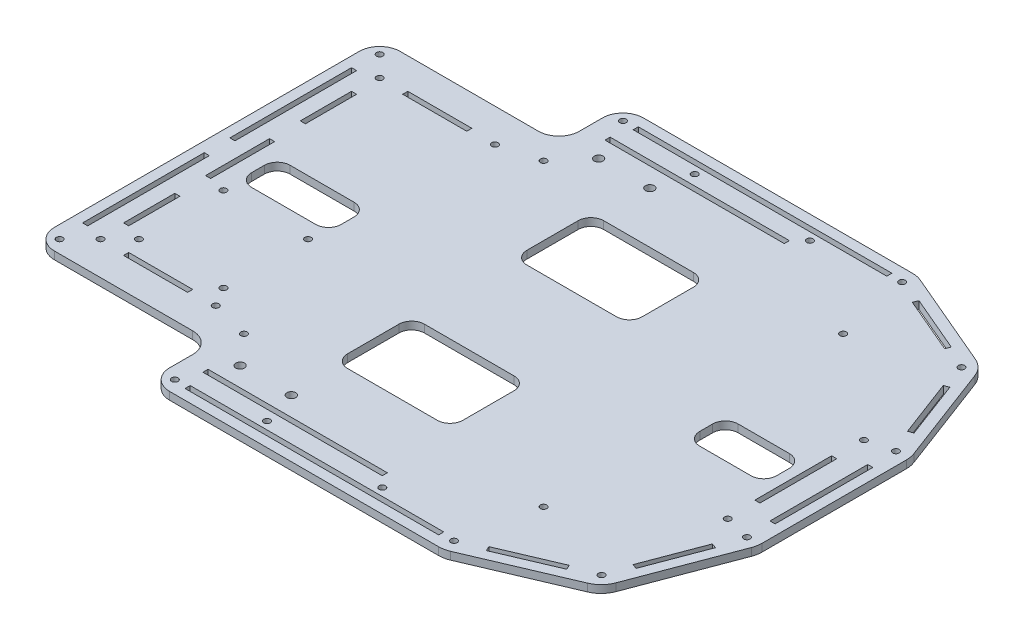
from build123d import *

# Parameters (mm, degrees)
ESTRUSIONE_ESTRUSIONE1_DEPTH  = 3
FORO_FILETTATO_M3X0_5_1_D     = 2.5
FORO_FILETTATO_M3X0_5_1_DEPTH = 7.5
FORO_FILETTATO_M3X0_5_1_TIP   = 0.751075774
SCHIZZO4_W                    = 89.03043591
SCHIZZO4_H                    = 2
TAGLIO_ESTRUSIONE2_DEPTH      = 10
FORO_FILETTATO_M3X0_5_7_D     = 2.5
SCHIZZO29_W                   = 5
SCHIZZO29_H                   = 2
TAGLIO_ESTRUSIONE13_DEPTH     = 10
SCHIZZO7_W                    = 2
SCHIZZO7_H                    = 47.5
TAGLIO_ESTRUSIONE5_DEPTH      = 10
SCHIZZO10_W                   = 2
SCHIZZO10_H                   = 38.172865154
TAGLIO_ESTRUSIONE6_DEPTH      = 262.897403576
FORO_FILETTATO_M3X0_5_2_D     = 2.5
SCHIZZO17_W                   = 25
SCHIZZO17_H                   = 2
SCHIZZO17_W_2                 = 2
SCHIZZO17_H_2                 = 20
SCHIZZO17_H_3                 = 25
TAGLIO_ESTRUSIONE9_DEPTH      = 10
SCHIZZO18_W                   = 70
SCHIZZO18_H                   = 2
TAGLIO_ESTRUSIONE10_DEPTH     = 10
FORO_FILETTATO_M3X0_5_3_D     = 2.5
SCHIZZO25_W                   = 2
SCHIZZO25_H                   = 30
TAGLIO_ESTRUSIONE11_DEPTH     = 10
FORO_FILETTATO_M3X0_5_6_D     = 2.5
SCHIZZO36_W                   = 30
SCHIZZO36_H                   = 15
TAGLIO_ESTRUSIONE15_DEPTH     = 10
SCHIZZO37_W                   = 35
SCHIZZO37_H                   = 15
TAGLIO_ESTRUSIONE16_DEPTH     = 10
SCHIZZO38_W                   = 45
SCHIZZO38_H                   = 30
TAGLIO_ESTRUSIONE17_DEPTH     = 10
FORO_FILETTATO_M3X0_5_9_D     = 2.5
RACCORDO1_R                   = 8
RACCORDO2_R                   = 10
RACCORDO3_R                   = 5
FORO_PER_VITE_M3_1_D          = 3.4


with BuildPart() as part:
    # Schizzo1 → Estrusione-Estrusione1 (new body)
    with BuildSketch(Plane(origin=(0, 0, 0), x_dir=(1, 0, 0), z_dir=(0, 1, 0))):
        Polygon((70, 67.5), (70, 92.5), (185.052105959, 92.5), (228.353376148, 74.033119315), (245, 30), (245, -30), (228.353376148, -74.033119315), (185.052105959, -92.5), (70, -92.5), (70, -67.5), (0, -67.5), (0, 67.5), align=None)
    extrude(amount=ESTRUSIONE_ESTRUSIONE1_DEPTH)

    # Foro filettato M3x0.5-1
    with Locations(Plane(origin=(0, 3, 0), x_dir=(1, 0, 0), z_dir=(0, 1, 0))):
        with Locations((224.430485984, 70.270415253), (240, 29.086432577), (240, -29.086432577), (224.430485984, -70.270415253), (184.03043591, -87.5), (184.03043591, 87.5), (75, 87.5), (75, -87.5), (5, -62.5), (5, 62.5)):
            Hole(FORO_FILETTATO_M3X0_5_1_D / 2, depth=FORO_FILETTATO_M3X0_5_1_DEPTH)
            with Locations((0, 0, -(FORO_FILETTATO_M3X0_5_1_DEPTH + FORO_FILETTATO_M3X0_5_1_TIP / 2))):  # 118° drill point
                Cone(0, FORO_FILETTATO_M3X0_5_1_D / 2, FORO_FILETTATO_M3X0_5_1_TIP, mode=Mode.SUBTRACT)

    # Schizzo4 → Taglio-Estrusione2 (cut)
    with BuildSketch(Plane(origin=(0, 3, 0), x_dir=(1, 0, 0), z_dir=(0, 1, 0))):
        with Locations((129.515217955, -87.5)):
            Rectangle(SCHIZZO4_W, SCHIZZO4_H)
        Polygon((235.52839554, 38.086696659), (227.03131331, 60.562907992), (228.902090444, 61.27015117), (237.399172674, 38.793939838), align=None)
        with Locations((129.515217955, 87.5)):
            Rectangle(SCHIZZO4_W, SCHIZZO4_H)
        Polygon((215.624354877, 75.113147429), (193.62114505, 84.496951848), (192.836567017, 82.657267824), (214.839776844, 73.273463404), align=None)
        Polygon((192.836567017, -82.657267824), (214.839776844, -73.273463404), (215.624354877, -75.113147429), (193.62114505, -84.496951848), align=None)
        Polygon((227.03131331, -60.562907992), (235.52839554, -38.086696659), (237.399172674, -38.793939838), (228.902090444, -61.27015117), align=None)
    extrude(amount=-TAGLIO_ESTRUSIONE2_DEPTH, mode=Mode.SUBTRACT)

    # Foro filettato M3x0.5-7 (through all)
    with Locations(Plane(origin=(0, 3, 0), x_dir=(1, 0, 0), z_dir=(0, 1, 0))):
        with Locations((107.015217955, -83.5), (152.015217955, -83.5)):
            foro_filettato_m3x0_5_7 = Hole(FORO_FILETTATO_M3X0_5_7_D / 2)

    # Schizzo29 → Taglio-Estrusione13 (cut)
    with BuildSketch(Plane(origin=(0, 3, 0), x_dir=(1, 0, 0), z_dir=(0, 1, 0))):
        with Locations((82.5, -87.5)):
            Rectangle(SCHIZZO29_W, SCHIZZO29_H)
        with Locations((176.53043591, -87.5)):
            Rectangle(SCHIZZO29_W, SCHIZZO29_H)
    taglio_estrusione13 = extrude(amount=-TAGLIO_ESTRUSIONE13_DEPTH, mode=Mode.SUBTRACT)

    # Specchia2: Foro filettato M3x0.5-7, Taglio-Estrusione13 across plane
    add(foro_filettato_m3x0_5_7.mirror(Plane.XY), mode=Mode.SUBTRACT)
    add(taglio_estrusione13.mirror(Plane.XY), mode=Mode.SUBTRACT)

    # Schizzo7 → Taglio-Estrusione5 (cut)
    with BuildSketch(Plane(origin=(0, 3, 0), x_dir=(1, 0, 0), z_dir=(0, 1, 0))):
        with Locations((5, 28.75)):
            Rectangle(SCHIZZO7_W, SCHIZZO7_H)
        with Locations((5, -28.75)):
            Rectangle(SCHIZZO7_W, SCHIZZO7_H)
    extrude(amount=-TAGLIO_ESTRUSIONE5_DEPTH, mode=Mode.SUBTRACT)

    # Schizzo10 → Taglio-Estrusione6 (cut, through all)
    with BuildSketch(Plane(origin=(0, 3, 0), x_dir=(1, 0, 0), z_dir=(0, 1, 0))):
        with Locations((240, 0)):
            Rectangle(SCHIZZO10_W, SCHIZZO10_H)
    extrude(amount=-TAGLIO_ESTRUSIONE6_DEPTH, mode=Mode.SUBTRACT)

    # Foro filettato M3x0.5-2 (through all)
    with Locations(Plane(origin=(0, 3, 0), x_dir=(1, 0, 0), z_dir=(0, 1, 0))):
        with Locations((13, 54.5), (13, -54.5), (58, -54.5), (58, 54.5)):
            Hole(FORO_FILETTATO_M3X0_5_2_D / 2)

    # Schizzo17 → Taglio-Estrusione9 (cut)
    with BuildSketch(Plane(origin=(0, 3, 0), x_dir=(1, 0, 0), z_dir=(0, 1, 0))):
        with Locations((35.5, -54.5)):
            Rectangle(SCHIZZO17_W, SCHIZZO17_H)
        with Locations((13, -34.5)):
            Rectangle(SCHIZZO17_W_2, SCHIZZO17_H_2)
        with Locations((13, 34.5)):
            Rectangle(SCHIZZO17_W_2, SCHIZZO17_H_2)
        with Locations((35.5, 54.5)):
            Rectangle(SCHIZZO17_W, SCHIZZO17_H)
        with Locations((13, 0)):
            Rectangle(SCHIZZO17_W_2, SCHIZZO17_H_3)
    extrude(amount=-TAGLIO_ESTRUSIONE9_DEPTH, mode=Mode.SUBTRACT)

    # Schizzo18 → Taglio-Estrusione10 (cut)
    with BuildSketch(Plane(origin=(0, 3, 0), x_dir=(1, 0, 0), z_dir=(0, 1, 0))):
        with Locations((113, 78.5)):
            Rectangle(SCHIZZO18_W, SCHIZZO18_H)
        with Locations((113, -78.5)):
            Rectangle(SCHIZZO18_W, SCHIZZO18_H)
    extrude(amount=-TAGLIO_ESTRUSIONE10_DEPTH, mode=Mode.SUBTRACT)

    # Foro filettato M3x0.5-3 (through all)
    with Locations(Plane(origin=(0, 3, 0), x_dir=(1, 0, 0), z_dir=(0, 1, 0))):
        with Locations((230, 26.586432577), (230, -26.586432577)):
            Hole(FORO_FILETTATO_M3X0_5_3_D / 2)

    # Schizzo25 → Taglio-Estrusione11 (cut)
    with BuildSketch(Plane(origin=(0, 3, 0), x_dir=(1, 0, 0), z_dir=(0, 1, 0))):
        with Locations((230, 0)):
            Rectangle(SCHIZZO25_W, SCHIZZO25_H)
    extrude(amount=-TAGLIO_ESTRUSIONE11_DEPTH, mode=Mode.SUBTRACT)

    # Foro filettato M3x0.5-6 (through all)
    with Locations(Plane(origin=(0, 3, 0), x_dir=(1, 0, 0), z_dir=(0, 1, 0))):
        with Locations((73, 58.5), (190, 58.5), (190, -58.5), (73, -58.5)):
            Hole(FORO_FILETTATO_M3X0_5_6_D / 2)

    # Schizzo36 → Taglio-Estrusione15 (cut)
    with BuildSketch(Plane(origin=(0, 3, 0), x_dir=(1, 0, 0), z_dir=(0, 1, 0))):
        with Locations((210, 0)):
            Rectangle(SCHIZZO36_W, SCHIZZO36_H)
    extrude(amount=-TAGLIO_ESTRUSIONE15_DEPTH, mode=Mode.SUBTRACT)

    # Schizzo37 → Taglio-Estrusione16 (cut)
    with BuildSketch(Plane(origin=(0, 3, 0), x_dir=(1, 0, 0), z_dir=(0, 1, 0))):
        with Locations((37.5, 0)):
            Rectangle(SCHIZZO37_W, SCHIZZO37_H)
    extrude(amount=-TAGLIO_ESTRUSIONE16_DEPTH, mode=Mode.SUBTRACT)

    # Schizzo38 → Taglio-Estrusione17 (cut)
    with BuildSketch(Plane(origin=(0, 3, 0), x_dir=(1, 0, 0), z_dir=(0, 1, 0))):
        with Locations((122.5, 35)):
            Rectangle(SCHIZZO38_W, SCHIZZO38_H)
        with Locations((122.5, -35)):
            Rectangle(SCHIZZO38_W, SCHIZZO38_H)
    extrude(amount=-TAGLIO_ESTRUSIONE17_DEPTH, mode=Mode.SUBTRACT)

    # Foro filettato M3x0.5-9 (through all)
    with Locations(Plane(origin=(0, 3, 0), x_dir=(1, 0, 0), z_dir=(0, 1, 0))):
        with Locations((20.49, -47.01), (53.51, -47.01), (53.51, -13.99), (20.49, -13.99)):
            Hole(FORO_FILETTATO_M3X0_5_9_D / 2)

    # Raccordo1
    raccordo1_edges = [part.edges().sort_by_distance(p)[0] for p in [
        (0, 1.5, -67.5),
        (70, 1.5, -67.5),
        (70, 1.5, -92.5),
        (70, 1.5, 92.5),
        (70, 1.5, 67.5),
        (0, 1.5, 67.5),
    ]]
    fillet(raccordo1_edges, radius=RACCORDO1_R)

    # Raccordo2
    raccordo2_edges = [part.edges().sort_by_distance(p)[0] for p in [
        (185.052105959, 1.5, -92.5),
        (228.353376148, 1.5, -74.033119315),
        (245, 1.5, -30),
        (245, 1.5, 30),
        (228.353376148, 1.5, 74.033119315),
        (185.052105959, 1.5, 92.5),
    ]]
    fillet(raccordo2_edges, radius=RACCORDO2_R)

    # Raccordo3
    raccordo3_edges = [part.edges().sort_by_distance(p)[0] for p in [
        (195, 1.5, 7.5),
        (195, 1.5, -7.5),
        (225, 1.5, -7.5),
        (225, 1.5, 7.5),
        (20, 1.5, 7.5),
        (20, 1.5, -7.5),
        (55, 1.5, -7.5),
        (55, 1.5, 7.5),
        (100, 1.5, -20),
        (100, 1.5, -50),
        (145, 1.5, -50),
        (145, 1.5, -20),
        (100, 1.5, 50),
        (100, 1.5, 20),
        (145, 1.5, 20),
        (145, 1.5, 50),
    ]]
    fillet(raccordo3_edges, radius=RACCORDO3_R)

    # Foro per Vite M3-1 (through all)
    with Locations(Plane(origin=(0, 3, 0), x_dir=(1, 0, 0), z_dir=(0, 1, 0))):
        with Locations((83, 70), (103, 70), (103, -70), (83, -70)):
            Hole(FORO_PER_VITE_M3_1_D / 2)


solid = part.part
